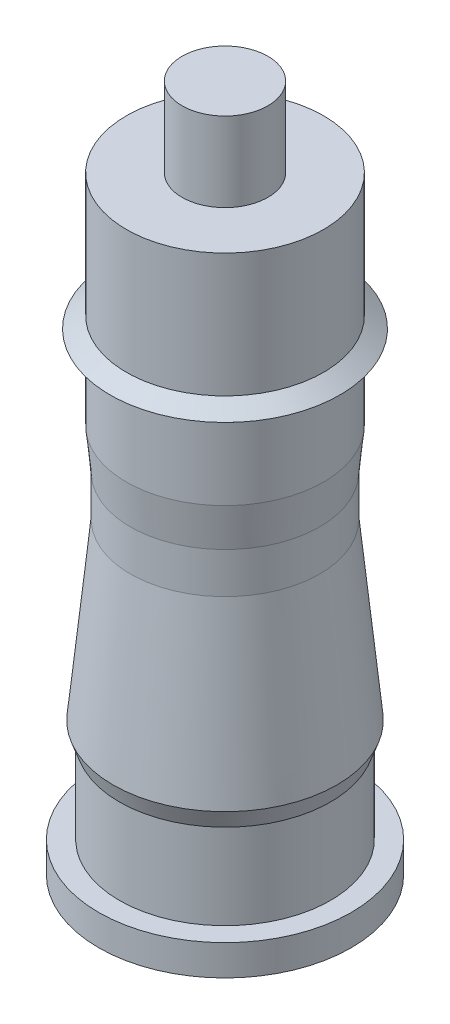
from build123d import *


with BuildPart() as part:
    # Sketch1 → Revolve1 (revolve)
    with BuildSketch(Plane.XY, mode=Mode.PRIVATE) as revolve1_sk:
        Polygon((0, 0), (6.9977, 0), (6.9977, 0.79375), (8.7757, 0.79375), (8.7757, 0), (9.8298, 0), (9.8298, 2.38125), (8.2169, 2.38125), (8.2169, 9.017), (8.7122, 10.414), (7.366, 23.9522), (7.366, 27.1272), (7.6708, 30.3022), (7.6708, 35.9156), (8.9408, 36.8046), (7.6708, 37.6936), (7.6708, 47.3202), (3.3401, 47.3202), (3.3401, 53.4924), (0, 53.4924), align=None)
    revolve(revolve1_sk.sketch.rotate(Axis((0, 0, 0), (0, 1, 0)), 90), axis=Axis((0, 0, 0), (0, 1, 0)))


solid = part.part
